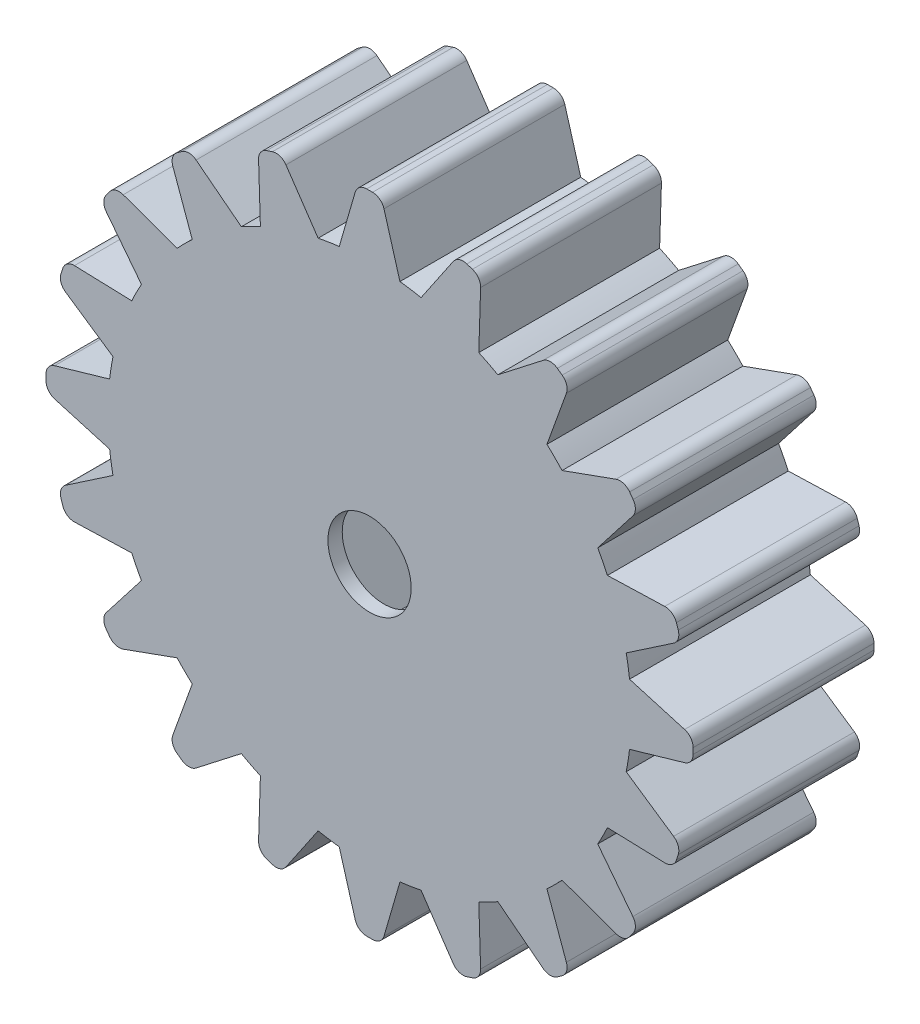
from build123d import *

# Parameters (mm, degrees)
BOSS_EXTRUDE1_DEPTH = 7.6
SKETCH4_R           = 1.75
CUT_EXTRUDE1_DEPTH  = 7
SKETCH5_R           = 1.75
CUT_EXTRUDE2_DEPTH  = 21.680425528


with BuildPart() as part:
    # Sketch1 → Boss-Extrude1 (new body)
    with BuildSketch(Plane.XY):
        with BuildLine():
            Line((-0.124457167, 13.6), (0.124457167, 13.6))
            ThreePointArc((0.124457167, 13.6), (0.424734881, 13.499791564), (0.604651154, 13.23933318))
            Line((0.604651154, 13.23933318), (1.275962124, 10.925745771))
            ThreePointArc((1.275962124, 10.925745771), (1.720779115, 10.864571747), (2.162729027, 10.785295692))
            Line((2.162729027, 10.785295692), (3.516121527, 12.778201575))
            ThreePointArc((3.516121527, 12.778201575), (3.767718138, 12.970315032), (4.084265323, 12.972828001))
            Line((4.084265323, 12.972828001), (4.320996924, 12.895909242))
            ThreePointArc((4.320996924, 12.895909242), (4.57561189, 12.70781444), (4.666236367, 12.40450661))
            Line((4.666236367, 12.40450661), (4.589753212, 9.996707731))
            ThreePointArc((4.589753212, 9.996707731), (4.993895497, 9.801071766), (5.389717192, 9.589105724))
            Line((5.389717192, 9.589105724), (7.292711734, 11.066250568))
            ThreePointArc((7.292711734, 11.066250568), (7.591360654, 11.171213695), (7.893191468, 11.075785211))
            Line((7.893191468, 11.075785211), (8.094567395, 10.929477036))
            ThreePointArc((8.094567395, 10.929477036), (8.278596127, 10.671907897), (8.271057853, 10.355440506))
            Line((8.271057853, 10.355440506), (7.454267277, 8.089122286))
            ThreePointArc((7.454267277, 8.089122286), (7.778174593, 7.778174593), (8.089122286, 7.454267277))
            Line((8.089122286, 7.454267277), (10.355440506, 8.271057853))
            ThreePointArc((10.355440506, 8.271057853), (10.671907897, 8.278596127), (10.929477036, 8.094567395))
            Line((10.929477036, 8.094567395), (11.075785211, 7.893191468))
            ThreePointArc((11.075785211, 7.893191468), (11.171213695, 7.591360654), (11.066250568, 7.292711734))
            Line((11.066250568, 7.292711734), (9.589105724, 5.389717192))
            ThreePointArc((9.589105724, 5.389717192), (9.801071766, 4.993895497), (9.996707731, 4.589753212))
            Line((9.996707731, 4.589753212), (12.40450661, 4.666236367))
            ThreePointArc((12.40450661, 4.666236367), (12.70781444, 4.57561189), (12.895909242, 4.320996924))
            Line((12.895909242, 4.320996924), (12.972828001, 4.084265323))
            ThreePointArc((12.972828001, 4.084265323), (12.970315032, 3.767718138), (12.778201575, 3.516121527))
            Line((12.778201575, 3.516121527), (10.785295692, 2.162729027))
            ThreePointArc((10.785295692, 2.162729027), (10.864571747, 1.720779115), (10.925745771, 1.275962124))
            Line((10.925745771, 1.275962124), (13.23933318, 0.604651154))
            ThreePointArc((13.23933318, 0.604651154), (13.499791564, 0.424734881), (13.6, 0.124457167))
            Line((13.6, 0.124457167), (13.6, -0.124457167))
            ThreePointArc((13.6, -0.124457167), (13.499791564, -0.424734881), (13.23933318, -0.604651154))
            Line((13.23933318, -0.604651154), (10.925745771, -1.275962124))
            ThreePointArc((10.925745771, -1.275962124), (10.864571747, -1.720779115), (10.785295692, -2.162729027))
            Line((10.785295692, -2.162729027), (12.778201575, -3.516121527))
            ThreePointArc((12.778201575, -3.516121527), (12.970315032, -3.767718138), (12.972828001, -4.084265323))
            Line((12.972828001, -4.084265323), (12.895909242, -4.320996924))
            ThreePointArc((12.895909242, -4.320996924), (12.70781444, -4.57561189), (12.40450661, -4.666236367))
            Line((12.40450661, -4.666236367), (9.996707731, -4.589753212))
            ThreePointArc((9.996707731, -4.589753212), (9.801071766, -4.993895497), (9.589105724, -5.389717192))
            Line((9.589105724, -5.389717192), (11.066250568, -7.292711734))
            ThreePointArc((11.066250568, -7.292711734), (11.171213695, -7.591360654), (11.075785211, -7.893191468))
            Line((11.075785211, -7.893191468), (10.929477036, -8.094567395))
            ThreePointArc((10.929477036, -8.094567395), (10.671907897, -8.278596127), (10.355440506, -8.271057853))
            Line((10.355440506, -8.271057853), (8.089122286, -7.454267277))
            ThreePointArc((8.089122286, -7.454267277), (7.778174593, -7.778174593), (7.454267277, -8.089122286))
            Line((7.454267277, -8.089122286), (8.271057853, -10.355440506))
            ThreePointArc((8.271057853, -10.355440506), (8.278596127, -10.671907897), (8.094567395, -10.929477036))
            Line((8.094567395, -10.929477036), (7.893191468, -11.075785211))
            ThreePointArc((7.893191468, -11.075785211), (7.591360654, -11.171213695), (7.292711734, -11.066250568))
            Line((7.292711734, -11.066250568), (5.389717192, -9.589105724))
            ThreePointArc((5.389717192, -9.589105724), (4.993895497, -9.801071766), (4.589753212, -9.996707731))
            Line((4.589753212, -9.996707731), (4.666236367, -12.40450661))
            ThreePointArc((4.666236367, -12.40450661), (4.57561189, -12.70781444), (4.320996924, -12.895909242))
            Line((4.320996924, -12.895909242), (4.084265323, -12.972828001))
            ThreePointArc((4.084265323, -12.972828001), (3.767718138, -12.970315032), (3.516121527, -12.778201575))
            Line((3.516121527, -12.778201575), (2.162729027, -10.785295692))
            ThreePointArc((2.162729027, -10.785295692), (1.720779115, -10.864571747), (1.275962124, -10.925745771))
            Line((1.275962124, -10.925745771), (0.604651154, -13.23933318))
            ThreePointArc((0.604651154, -13.23933318), (0.424734881, -13.499791564), (0.124457167, -13.6))
            Line((0.124457167, -13.6), (-0.124457167, -13.6))
            ThreePointArc((-0.124457167, -13.6), (-0.424734881, -13.499791564), (-0.604651154, -13.23933318))
            Line((-0.604651154, -13.23933318), (-1.275962124, -10.925745771))
            ThreePointArc((-1.275962124, -10.925745771), (-1.720779115, -10.864571747), (-2.162729027, -10.785295692))
            Line((-2.162729027, -10.785295692), (-3.516121527, -12.778201575))
            ThreePointArc((-3.516121527, -12.778201575), (-3.767718138, -12.970315032), (-4.084265323, -12.972828001))
            Line((-4.084265323, -12.972828001), (-4.320996924, -12.895909242))
            ThreePointArc((-4.320996924, -12.895909242), (-4.57561189, -12.70781444), (-4.666236367, -12.40450661))
            Line((-4.666236367, -12.40450661), (-4.589753212, -9.996707731))
            ThreePointArc((-4.589753212, -9.996707731), (-4.993895497, -9.801071766), (-5.389717192, -9.589105724))
            Line((-5.389717192, -9.589105724), (-7.292711734, -11.066250568))
            ThreePointArc((-7.292711734, -11.066250568), (-7.591360654, -11.171213695), (-7.893191468, -11.075785211))
            Line((-7.893191468, -11.075785211), (-8.094567395, -10.929477036))
            ThreePointArc((-8.094567395, -10.929477036), (-8.278596127, -10.671907897), (-8.271057853, -10.355440506))
            Line((-8.271057853, -10.355440506), (-7.454267277, -8.089122286))
            ThreePointArc((-7.454267277, -8.089122286), (-7.778174593, -7.778174593), (-8.089122286, -7.454267277))
            Line((-8.089122286, -7.454267277), (-10.355440506, -8.271057853))
            ThreePointArc((-10.355440506, -8.271057853), (-10.671907897, -8.278596127), (-10.929477036, -8.094567395))
            Line((-10.929477036, -8.094567395), (-11.075785211, -7.893191468))
            ThreePointArc((-11.075785211, -7.893191468), (-11.171213695, -7.591360654), (-11.066250568, -7.292711734))
            Line((-11.066250568, -7.292711734), (-9.589105724, -5.389717192))
            ThreePointArc((-9.589105724, -5.389717192), (-9.801071766, -4.993895497), (-9.996707731, -4.589753212))
            Line((-9.996707731, -4.589753212), (-12.40450661, -4.666236367))
            ThreePointArc((-12.40450661, -4.666236367), (-12.70781444, -4.57561189), (-12.895909242, -4.320996924))
            Line((-12.895909242, -4.320996924), (-12.972828001, -4.084265323))
            ThreePointArc((-12.972828001, -4.084265323), (-12.970315032, -3.767718138), (-12.778201575, -3.516121527))
            Line((-12.778201575, -3.516121527), (-10.785295692, -2.162729027))
            ThreePointArc((-10.785295692, -2.162729027), (-10.864571747, -1.720779115), (-10.925745771, -1.275962124))
            Line((-10.925745771, -1.275962124), (-13.23933318, -0.604651154))
            ThreePointArc((-13.23933318, -0.604651154), (-13.499791564, -0.424734881), (-13.6, -0.124457167))
            Line((-13.6, -0.124457167), (-13.6, 0.124457167))
            ThreePointArc((-13.6, 0.124457167), (-13.499791564, 0.424734881), (-13.23933318, 0.604651154))
            Line((-13.23933318, 0.604651154), (-10.925745771, 1.275962124))
            ThreePointArc((-10.925745771, 1.275962124), (-10.864571747, 1.720779115), (-10.785295692, 2.162729027))
            Line((-10.785295692, 2.162729027), (-12.778201575, 3.516121527))
            ThreePointArc((-12.778201575, 3.516121527), (-12.970315032, 3.767718138), (-12.972828001, 4.084265323))
            Line((-12.972828001, 4.084265323), (-12.895909242, 4.320996924))
            ThreePointArc((-12.895909242, 4.320996924), (-12.70781444, 4.57561189), (-12.40450661, 4.666236367))
            Line((-12.40450661, 4.666236367), (-9.996707731, 4.589753212))
            ThreePointArc((-9.996707731, 4.589753212), (-9.801071766, 4.993895497), (-9.589105724, 5.389717192))
            Line((-9.589105724, 5.389717192), (-11.066250568, 7.292711734))
            ThreePointArc((-11.066250568, 7.292711734), (-11.171213695, 7.591360654), (-11.075785211, 7.893191468))
            Line((-11.075785211, 7.893191468), (-10.929477036, 8.094567395))
            ThreePointArc((-10.929477036, 8.094567395), (-10.671907897, 8.278596127), (-10.355440506, 8.271057853))
            Line((-10.355440506, 8.271057853), (-8.089122286, 7.454267277))
            ThreePointArc((-8.089122286, 7.454267277), (-7.778174593, 7.778174593), (-7.454267277, 8.089122286))
            Line((-7.454267277, 8.089122286), (-8.271057853, 10.355440506))
            ThreePointArc((-8.271057853, 10.355440506), (-8.278596127, 10.671907897), (-8.094567395, 10.929477036))
            Line((-8.094567395, 10.929477036), (-7.893191468, 11.075785211))
            ThreePointArc((-7.893191468, 11.075785211), (-7.591360654, 11.171213695), (-7.292711734, 11.066250568))
            Line((-7.292711734, 11.066250568), (-5.389717192, 9.589105724))
            ThreePointArc((-5.389717192, 9.589105724), (-4.993895497, 9.801071766), (-4.589753212, 9.996707731))
            Line((-4.589753212, 9.996707731), (-4.666236367, 12.40450661))
            ThreePointArc((-4.666236367, 12.40450661), (-4.57561189, 12.70781444), (-4.320996924, 12.895909242))
            Line((-4.320996924, 12.895909242), (-4.084265323, 12.972828001))
            ThreePointArc((-4.084265323, 12.972828001), (-3.767718138, 12.970315032), (-3.516121527, 12.778201575))
            Line((-3.516121527, 12.778201575), (-2.162729027, 10.785295692))
            ThreePointArc((-2.162729027, 10.785295692), (-1.720779115, 10.864571747), (-1.275962124, 10.925745771))
            Line((-1.275962124, 10.925745771), (-0.604651154, 13.23933318))
            ThreePointArc((-0.604651154, 13.23933318), (-0.424734881, 13.499791564), (-0.124457167, 13.6))
        make_face()
    extrude(amount=BOSS_EXTRUDE1_DEPTH)

    # Sketch4 → Cut-Extrude1 (cut)
    with BuildSketch(Plane(origin=(0, 0, 0), x_dir=(-1, 0, 0), z_dir=(0, 0, -1))):
        Polygon((-6.926368188, -0.15944818), (-3.325097919, -6.078134897), (3.601270269, -5.918686717), (6.926368188, 0.15944818), (3.325097919, 6.078134897), (-3.601270269, 5.918686717), align=None)
        Circle(SKETCH4_R, mode=Mode.SUBTRACT)
    extrude(amount=-CUT_EXTRUDE1_DEPTH, mode=Mode.SUBTRACT)

    # Sketch5 → Cut-Extrude2 (cut, through all)
    with BuildSketch(Plane(origin=(0, 0, 0), x_dir=(-1, 0, 0), z_dir=(0, 0, -1))):
        Circle(SKETCH5_R)
    extrude(amount=-CUT_EXTRUDE2_DEPTH, mode=Mode.SUBTRACT)


solid = part.part
